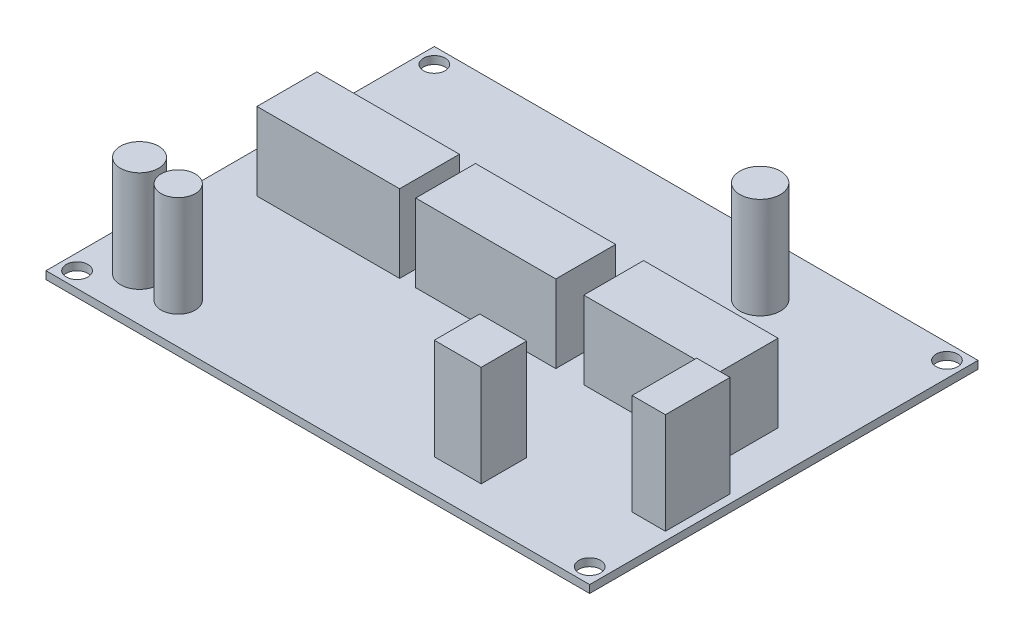
from build123d import *

# Parameters (mm, degrees)
SKETCH1_W           = 70
SKETCH1_H           = 50
BOSS_EXTRUDE1_DEPTH = 1
SKETCH2_R           = 1.4
CUT_EXTRUDE1_DEPTH  = 87.029064856
SKETCH3_W           = 18.365703091
SKETCH3_H           = 7.700561822
SKETCH3_W_2         = 18.038456085
SKETCH3_W_3         = 17.313956014
BOSS_EXTRUDE2_DEPTH = 10
SKETCH4_R           = 2.199397545
SKETCH4_R_2         = 2.613331078
SKETCH4_W           = 6.039158021
SKETCH4_H           = 5.855225109
SKETCH4_W_2         = 4.288386861
SKETCH4_H_2         = 8.320722996
BOSS_EXTRUDE3_DEPTH = 13
SKETCH5_R           = 2.461468561
BOSS_EXTRUDE4_DEPTH = 13


with BuildPart() as part:
    # Sketch1 → Boss-Extrude1 (new body)
    with BuildSketch(Plane(origin=(0, 0, 0), x_dir=(1, 0, 0), z_dir=(0, 1, 0))):
        with Locations((35, 25)):
            Rectangle(SKETCH1_W, SKETCH1_H)
    extrude(amount=BOSS_EXTRUDE1_DEPTH)

    # Sketch2 → Cut-Extrude1 (cut, through all)
    with BuildSketch(Plane(origin=(0, 1, 0), x_dir=(1, 0, 0), z_dir=(0, 1, 0))):
        with Locations(Location((2, 48, 0), (0, 0, 270))):
            Circle(SKETCH2_R)
        with Locations(Location((68, 48, 0), (0, 0, 270))):
            Circle(SKETCH2_R)
        with Locations(Location((68, 2, 0), (0, 0, 270))):
            Circle(SKETCH2_R)
        with Locations(Location((2, 2, 0), (0, 0, 270))):
            Circle(SKETCH2_R)
    extrude(amount=-CUT_EXTRUDE1_DEPTH, mode=Mode.SUBTRACT)

    # Sketch3 → Boss-Extrude2 (add)
    with BuildSketch(Plane(origin=(0, 1, 0), x_dir=(1, 0, 0), z_dir=(0, 1, 0))):
        with Locations((14.447202749, 25.749679834)):
            Rectangle(SKETCH3_W, SKETCH3_H)
        with Locations((34.720477754, 25.749679834)):
            Rectangle(SKETCH3_W_2, SKETCH3_H)
        with Locations((56.000727736, 25.749679834)):
            Rectangle(SKETCH3_W_3, SKETCH3_H)
    extrude(amount=BOSS_EXTRUDE2_DEPTH)

    # Sketch4 → Boss-Extrude3 (add)
    with BuildSketch(Plane(origin=(0, 1, 0), x_dir=(1, 0, 0), z_dir=(0, 1, 0))):
        with Locations(Location((11.812429649, 5.207282589, 0), (0, 0, 90))):
            Circle(SKETCH4_R)
        with Locations(Location((49.177509177, 42.774595264, 0), (0, 0, 90))):
            Circle(SKETCH4_R_2)
        with Locations((48.771261245, 7.170254424)):
            Rectangle(SKETCH4_W, SKETCH4_H)
        with Locations((66.789850866, 14.979105773)):
            Rectangle(SKETCH4_W_2, SKETCH4_H_2)
    extrude(amount=BOSS_EXTRUDE3_DEPTH)

    # Sketch5 → Boss-Extrude4 (add)
    with BuildSketch(Plane(origin=(0, 1, 0), x_dir=(1, 0, 0), z_dir=(0, 1, 0))):
        with Locations(Location((6.367279466, 5.676618651, 0), (0, 0, 90))):
            Circle(SKETCH5_R)
    extrude(amount=BOSS_EXTRUDE4_DEPTH)


solid = part.part
